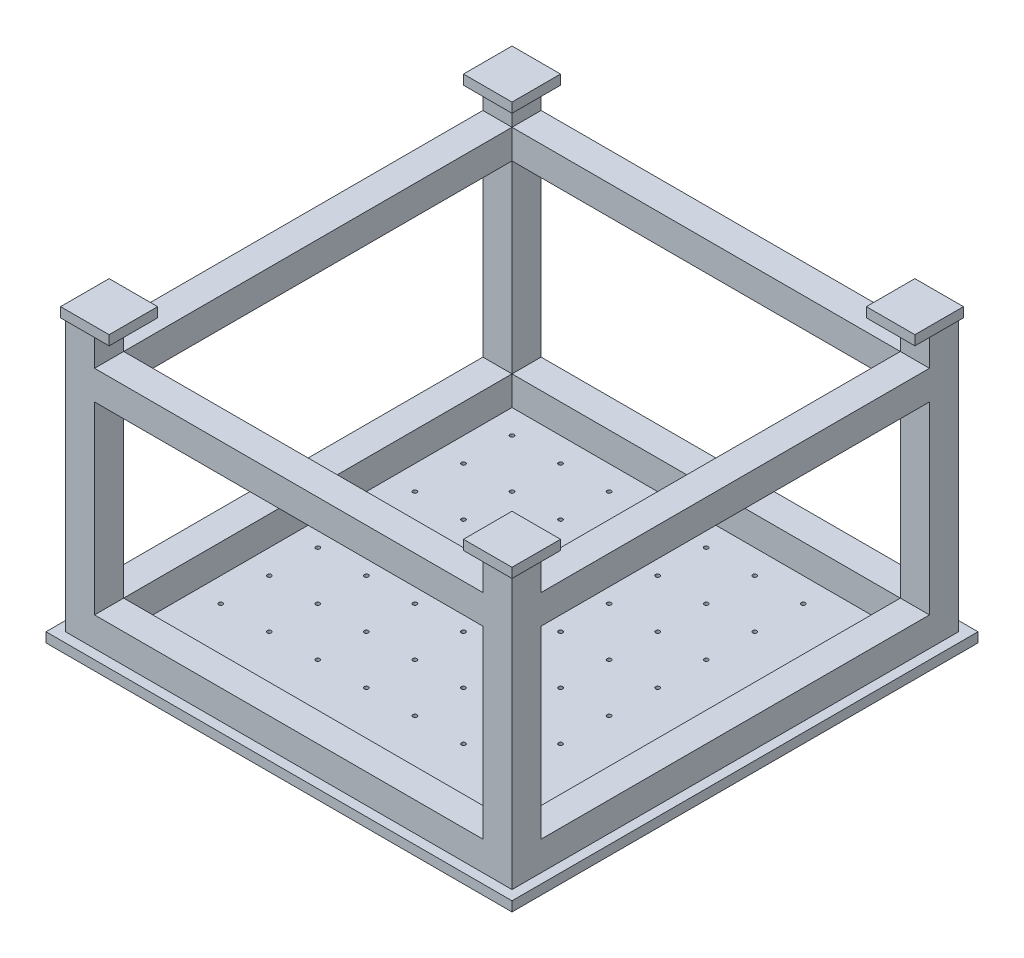
from build123d import *

# Parameters (mm, degrees)
SKETCH1_W               = 1219.2
SKETCH1_H               = 1219.2
BOSS_EXTRUDE1_DEPTH     = 25.4
SKETCH2_W               = 76.2
SKETCH2_H               = 76.2
BOSS_EXTRUDE2_DEPTH     = 711.2
BOSS_EXTRUDE3_REACH     = 1812.541
SKETCH3_W               = 76.2
SKETCH3_H               = 76.2
BOSS_EXTRUDE4_REACH     = 1812.541
SKETCH4_W               = 76.2
SKETCH4_H               = 76.2
SKETCH5_W               = 127
SKETCH5_H               = 127
BOSS_EXTRUDE5_DEPTH     = 25.4
F_1_2_13_TAPPED_HOLE1_D = 10.71626


with BuildPart() as part:
    # Sketch1 → Boss-Extrude1 (new body)
    with BuildSketch(Plane(origin=(0, 0, 0), x_dir=(1, 0, 0), z_dir=(0, 1, 0))):
        with Locations((609.6, 609.6)):
            Rectangle(SKETCH1_W, SKETCH1_H)
    extrude(amount=BOSS_EXTRUDE1_DEPTH)

    # Sketch2 → Boss-Extrude2 (add)
    with BuildSketch(Plane(origin=(0, 25.4, 0), x_dir=(1, 0, 0), z_dir=(0, 1, 0))):
        with Locations((63.5, 1155.7)):
            Rectangle(SKETCH2_W, SKETCH2_H)
        with Locations((1155.7, 1155.7)):
            Rectangle(SKETCH2_W, SKETCH2_H)
        with Locations((1155.7, 63.5)):
            Rectangle(SKETCH2_W, SKETCH2_H)
        with Locations((63.5, 63.5)):
            Rectangle(SKETCH2_W, SKETCH2_H)
    extrude(amount=BOSS_EXTRUDE2_DEPTH)

    # Sketch3 → Boss-Extrude3 (add, up to next)
    with BuildSketch(Plane(origin=(0, 0, -101.6), x_dir=(-1, 0, 0), z_dir=(0, 0, -1)), mode=Mode.PRIVATE) as boss_extrude3_sk1:
        with Locations((-63.5, 63.5)):
            Rectangle(SKETCH3_W, SKETCH3_H)
    boss_extrude3_tool1 = extrude(boss_extrude3_sk1.sketch, amount=BOSS_EXTRUDE3_REACH, mode=Mode.PRIVATE) - part.part
    # Sketch3 → Boss-Extrude3 (add, up to next)
    with BuildSketch(Plane(origin=(0, 0, -101.6), x_dir=(-1, 0, 0), z_dir=(0, 0, -1)), mode=Mode.PRIVATE) as boss_extrude3_sk2:
        with Locations((-1155.7, 63.5)):
            Rectangle(SKETCH3_W, SKETCH3_H)
    boss_extrude3_tool2 = extrude(boss_extrude3_sk2.sketch, amount=BOSS_EXTRUDE3_REACH, mode=Mode.PRIVATE) - part.part
    # Sketch3 → Boss-Extrude3 (add, up to next)
    with BuildSketch(Plane(origin=(0, 0, -101.6), x_dir=(-1, 0, 0), z_dir=(0, 0, -1)), mode=Mode.PRIVATE) as boss_extrude3_sk3:
        with Locations((-63.5, 622.3)):
            Rectangle(SKETCH3_W, SKETCH3_H)
    boss_extrude3_tool3 = extrude(boss_extrude3_sk3.sketch, amount=BOSS_EXTRUDE3_REACH, mode=Mode.PRIVATE) - part.part
    # Sketch3 → Boss-Extrude3 (add, up to next)
    with BuildSketch(Plane(origin=(0, 0, -101.6), x_dir=(-1, 0, 0), z_dir=(0, 0, -1)), mode=Mode.PRIVATE) as boss_extrude3_sk4:
        with Locations((-1155.7, 622.3)):
            Rectangle(SKETCH3_W, SKETCH3_H)
    boss_extrude3_tool4 = extrude(boss_extrude3_sk4.sketch, amount=BOSS_EXTRUDE3_REACH, mode=Mode.PRIVATE) - part.part
    add(boss_extrude3_tool1.solids().sort_by_distance((63.5, 63.5, -101.6))[0])
    add(boss_extrude3_tool2.solids().sort_by_distance((1155.7, 63.5, -101.6))[0])
    add(boss_extrude3_tool3.solids().sort_by_distance((63.5, 622.3, -101.6))[0])
    add(boss_extrude3_tool4.solids().sort_by_distance((1155.7, 622.3, -101.6))[0])

    # Sketch4 → Boss-Extrude4 (add, up to next)
    with BuildSketch(Plane.ZY.offset(-1117.6), mode=Mode.PRIVATE) as boss_extrude4_sk1:
        with Locations((-63.5, 63.5)):
            Rectangle(SKETCH4_W, SKETCH4_H)
    boss_extrude4_tool1 = extrude(boss_extrude4_sk1.sketch, amount=BOSS_EXTRUDE4_REACH, mode=Mode.PRIVATE) - part.part
    # Sketch4 → Boss-Extrude4 (add, up to next)
    with BuildSketch(Plane.ZY.offset(-1117.6), mode=Mode.PRIVATE) as boss_extrude4_sk2:
        with Locations((-1155.7, 63.5)):
            Rectangle(SKETCH4_W, SKETCH4_H)
    boss_extrude4_tool2 = extrude(boss_extrude4_sk2.sketch, amount=BOSS_EXTRUDE4_REACH, mode=Mode.PRIVATE) - part.part
    # Sketch4 → Boss-Extrude4 (add, up to next)
    with BuildSketch(Plane.ZY.offset(-1117.6), mode=Mode.PRIVATE) as boss_extrude4_sk3:
        with Locations((-63.5, 622.3)):
            Rectangle(SKETCH4_W, SKETCH4_H)
    boss_extrude4_tool3 = extrude(boss_extrude4_sk3.sketch, amount=BOSS_EXTRUDE4_REACH, mode=Mode.PRIVATE) - part.part
    # Sketch4 → Boss-Extrude4 (add, up to next)
    with BuildSketch(Plane.ZY.offset(-1117.6), mode=Mode.PRIVATE) as boss_extrude4_sk4:
        with Locations((-1155.7, 622.3)):
            Rectangle(SKETCH4_W, SKETCH4_H)
    boss_extrude4_tool4 = extrude(boss_extrude4_sk4.sketch, amount=BOSS_EXTRUDE4_REACH, mode=Mode.PRIVATE) - part.part
    add(boss_extrude4_tool1.solids().sort_by_distance((1117.6, 63.5, -63.5))[0])
    add(boss_extrude4_tool2.solids().sort_by_distance((1117.6, 63.5, -1155.7))[0])
    add(boss_extrude4_tool3.solids().sort_by_distance((1117.6, 622.3, -63.5))[0])
    add(boss_extrude4_tool4.solids().sort_by_distance((1117.6, 622.3, -1155.7))[0])

    # Sketch5 → Boss-Extrude5 (add)
    with BuildSketch(Plane(origin=(0, 736.6, 0), x_dir=(1, 0, 0), z_dir=(0, 1, 0))):
        with Locations((82.55, 82.55)):
            Rectangle(SKETCH5_W, SKETCH5_H)
        with Locations((1136.65, 82.55)):
            Rectangle(SKETCH5_W, SKETCH5_H)
        with Locations((1136.65, 1136.65)):
            Rectangle(SKETCH5_W, SKETCH5_H)
        with Locations((82.55, 1136.65)):
            Rectangle(SKETCH5_W, SKETCH5_H)
    extrude(amount=BOSS_EXTRUDE5_DEPTH)

    # 1/2-13 Tapped Hole1 (through all)
    with Locations(Plane(origin=(0, 0, 0), x_dir=(-1, 0, 0), z_dir=(0, -1, 0))):
        with Locations((-673.1, 546.1), (-546.1, 546.1), (-419.1, 546.1), (-292.1, 546.1), (-165.1, 546.1), (-546.1, 419.1), (-419.1, 419.1), (-292.1, 419.1), (-165.1, 419.1), (-546.1, 292.1), (-419.1, 292.1), (-292.1, 292.1), (-165.1, 292.1), (-546.1, 165.1), (-419.1, 165.1), (-292.1, 165.1), (-165.1, 165.1), (-673.1, 419.1), (-673.1, 292.1), (-673.1, 165.1), (-165.1, 673.1), (-673.1, 1054.1), (-673.1, 927.1), (-673.1, 800.1), (-165.1, 1054.1), (-292.1, 1054.1), (-419.1, 1054.1), (-546.1, 1054.1), (-165.1, 927.1), (-292.1, 927.1), (-419.1, 927.1), (-546.1, 927.1), (-165.1, 800.1), (-292.1, 800.1), (-419.1, 800.1), (-546.1, 800.1), (-292.1, 673.1), (-419.1, 673.1), (-546.1, 673.1), (-673.1, 673.1), (-800.1, 673.1), (-927.1, 673.1), (-800.1, 800.1), (-927.1, 800.1), (-1054.1, 800.1), (-800.1, 927.1), (-927.1, 927.1), (-1054.1, 927.1), (-800.1, 1054.1), (-927.1, 1054.1), (-1054.1, 1054.1), (-1054.1, 673.1), (-1054.1, 165.1), (-927.1, 165.1), (-800.1, 165.1), (-1054.1, 292.1), (-927.1, 292.1), (-800.1, 292.1), (-1054.1, 419.1), (-927.1, 419.1), (-800.1, 419.1), (-1054.1, 546.1), (-927.1, 546.1), (-800.1, 546.1)):
            Hole(F_1_2_13_TAPPED_HOLE1_D / 2)


solid = part.part
